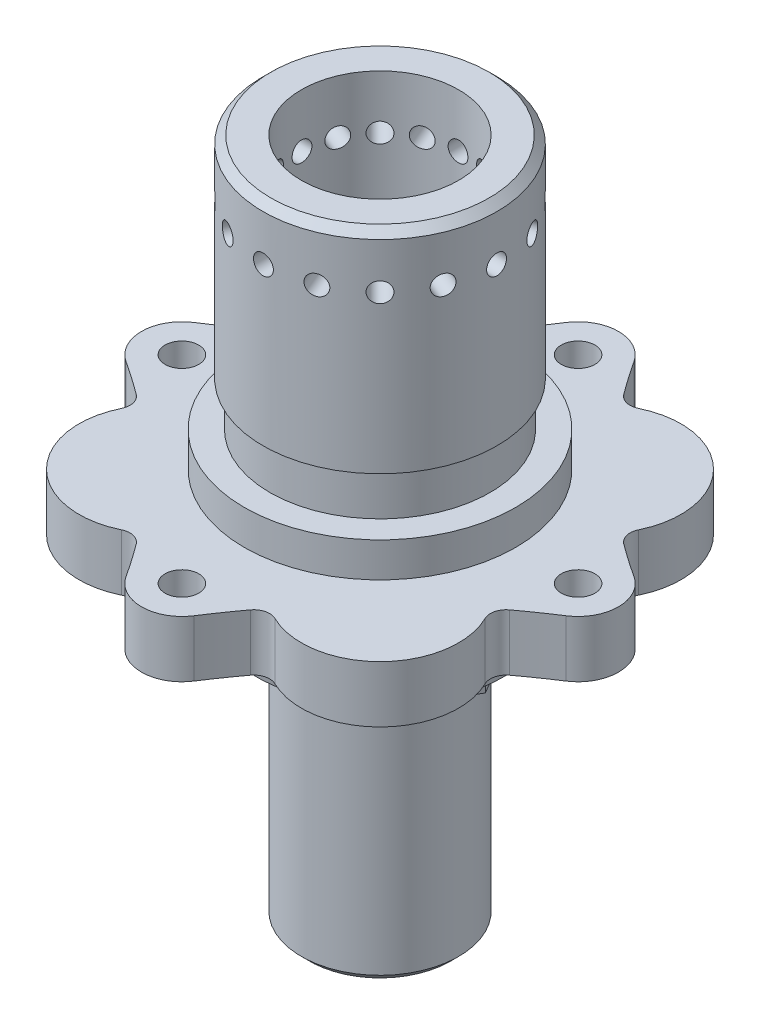
from build123d import *

# Parameters (mm, degrees)
SKETCH5_W                     = 15.875
SKETCH5_H                     = 79.375
DRIVE_PIN_HOLES_D             = 6.8
DRIVE_PIN_HOLES_PATTERN_COUNT = 4
FLANGE_SUPPORT_CUT_REACH      = 103.939
SKETCH8_R                     = 52.5
SKETCH10_R                    = 25.0825
BRAKE_HAT_HEX_DEPTH           = 4.7625
M10_CLEARANCE_HOLE1_D         = 11
SKETCH14_R                    = 2
PIN_HOLES_DEPTH               = 98.561648779
PIN_HOLE_PATTERN_COUNT        = 16
FILLET1_R                     = 3.175


with BuildPart() as part:
    # Sketch1 → Bearing Shaft/Flange Support (revolve)
    with BuildSketch(Plane(origin=(0, 0, 0), x_dir=(0, 0, -1), z_dir=(1, 0, 0)), mode=Mode.PRIVATE) as bearing_shaft_flange_support_sk:
        Polygon((0, 0), (-27.254672075, 0), (-25.0825, -12.319), (-25.0825, -17.0815), (-15.875, -17.0815), (-15.875, -65.8749), (-14.2875, -67.4624), (0, -67.4624), align=None)
    revolve(bearing_shaft_flange_support_sk.sketch.rotate(Axis((0, 0, 0), (0, 1, 0)), 180), axis=Axis((0, 0, 0), (0, 1, 0)))

    # Sketch2 → Drive Pin Support (revolve)
    with BuildSketch(Plane(origin=(0, 0, 0), x_dir=(0, 0, -1), z_dir=(1, 0, 0)), mode=Mode.PRIVATE) as drive_pin_support_sk:
        Polygon((0, 0), (-52.5, 0), (-52.5, 11.43), (-27.4096, 11.43), (-27.4096, 18.43), (-22.225, 18.43), (-22.225, 27.305), (-23.61946, 27.305), (-23.61946, 68.2625), (-22.03196, 69.85), (0, 69.85), align=None)
    revolve(drive_pin_support_sk.sketch.rotate(Axis((0, 0, 0), (0, 1, 0)), 180), axis=Axis((0, 0, 0), (0, 1, 0)))

    # Sketch5 → Center Mass Removal (revolve, cut)
    with BuildSketch(Plane(origin=(0, 0, 0), x_dir=(0, 0, -1), z_dir=(1, 0, 0)), mode=Mode.PRIVATE) as center_mass_removal_sk:
        with Locations((7.9375, 30.1625)):
            Rectangle(SKETCH5_W, SKETCH5_H)
    revolve(center_mass_removal_sk.sketch.rotate(Axis((0, 0, 0), (0, -1, 0)), 180), axis=Axis((0, 0, 0), (0, -1, 0)), mode=Mode.SUBTRACT)

    # Drive Pin Holes (through all)
    with Locations(Plane(origin=(0, 0, 0), x_dir=(-1, 0, 0), z_dir=(0, -1, 0))):
        with Locations((0, -40)):
            drive_pin_holes = Hole(DRIVE_PIN_HOLES_D / 2)

    # Drive Pin Holes Pattern: Drive Pin Holes ×4 about axis
    drive_pin_holes_pattern_axis = Axis((0, 0, 0), (0, 1, 0))
    for i in range(1, DRIVE_PIN_HOLES_PATTERN_COUNT):
        add(drive_pin_holes.rotate(drive_pin_holes_pattern_axis, i * 360 / DRIVE_PIN_HOLES_PATTERN_COUNT), mode=Mode.SUBTRACT)

    # Sketch8 → Flange Support Cut (cut, up to next)
    with BuildSketch(Plane.XZ, mode=Mode.PRIVATE) as flange_support_cut_sk1:
        Circle(SKETCH8_R)
        with BuildLine():
            ThreePointArc((6.851776468, 44.436165629), (0, 48.1625), (-6.851776468, 44.436165629))
            ThreePointArc((-6.851776468, 44.436165629), (-9.964767607, 39.850591878), (-13.274865482, 35.405206349))
            ThreePointArc((-13.274865482, 35.405206349), (-33.675960454, 33.675960454), (-35.405206349, 13.274865482))
            ThreePointArc((-35.405206349, 13.274865482), (-39.850591878, 9.964767607), (-44.436165629, 6.851776468))
            ThreePointArc((-44.436165629, 6.851776468), (-48.1625, 0), (-44.436165629, -6.851776468))
            ThreePointArc((-44.436165629, -6.851776468), (-39.850591878, -9.964767607), (-35.405206349, -13.274865482))
            ThreePointArc((-35.405206349, -13.274865482), (-33.675960454, -33.675960454), (-13.274865482, -35.405206349))
            ThreePointArc((-13.274865482, -35.405206349), (-9.964767607, -39.850591878), (-6.851776468, -44.436165629))
            ThreePointArc((-6.851776468, -44.436165629), (0, -48.1625), (6.851776468, -44.436165629))
            ThreePointArc((6.851776468, -44.436165629), (9.964767607, -39.850591878), (13.274865482, -35.405206349))
            ThreePointArc((13.274865482, -35.405206349), (33.675960454, -33.675960454), (35.405206349, -13.274865482))
            ThreePointArc((35.405206349, -13.274865482), (39.850591878, -9.964767607), (44.436165629, -6.851776468))
            ThreePointArc((44.436165629, -6.851776468), (48.1625, 0), (44.436165629, 6.851776468))
            ThreePointArc((44.436165629, 6.851776468), (39.850591878, 9.964767607), (35.405206349, 13.274865482))
            ThreePointArc((35.405206349, 13.274865482), (33.675960454, 33.675960454), (13.274865482, 35.405206349))
            ThreePointArc((13.274865482, 35.405206349), (9.964767607, 39.850591878), (6.851776468, 44.436165629))
        make_face(mode=Mode.SUBTRACT)
    flange_support_cut_tool1 = extrude(flange_support_cut_sk1.sketch, amount=-FLANGE_SUPPORT_CUT_REACH, mode=Mode.PRIVATE) & part.part
    add(flange_support_cut_tool1.solids().sort_by_distance((-51.015076, 0, 0))[0], mode=Mode.SUBTRACT)

    # Sketch10 → Brake Hat Hex (cut)
    with BuildSketch(Plane.XZ.offset(17.0815)):
        Circle(SKETCH10_R)
        Polygon((10.631905207, -18.415), (21.263810414, 0), (10.631905207, 18.415), (-10.631905207, 18.415), (-21.263810414, 0), (-10.631905207, -18.415), align=None, mode=Mode.SUBTRACT)
    extrude(amount=-BRAKE_HAT_HEX_DEPTH, mode=Mode.SUBTRACT)

    # M10 Clearance Hole1 (through all)
    with Locations(Plane(origin=(0, -67.4624, 0), x_dir=(-1, 0, 0), z_dir=(0, -1, 0))):
        with Locations((0, 0)):
            Hole(M10_CLEARANCE_HOLE1_D / 2)

    # Sketch14 → Pin Holes (cut, through all)
    with BuildSketch(Plane(origin=(0, 0, 0), x_dir=(0, 0, -1), z_dir=(1, 0, 0))):
        with Locations((0, 59.05)):
            Circle(SKETCH14_R)
    pin_holes = extrude(amount=-PIN_HOLES_DEPTH, mode=Mode.SUBTRACT)

    # Pin Hole Pattern: Pin Holes ×16 about axis
    pin_hole_pattern_axis = Axis((0, 0, 0), (0, -1, 0))
    for i in range(1, PIN_HOLE_PATTERN_COUNT):
        add(pin_holes.rotate(pin_hole_pattern_axis, i * 360 / PIN_HOLE_PATTERN_COUNT), mode=Mode.SUBTRACT)

    # Fillet1
    fillet1_edges = [part.edges().sort_by_distance(p)[0] for p in [
        (-35.405206349, 5.715, -13.274865482),
        (-13.274865482, 5.715, -35.405206349),
        (13.274865482, 5.715, -35.405206349),
        (35.405206349, 5.715, -13.274865482),
        (35.405206349, 5.715, 13.274865482),
        (13.274865482, 5.715, 35.405206349),
        (-13.274865482, 5.715, 35.405206349),
        (-35.405206349, 5.715, 13.274865482),
    ]]
    fillet(fillet1_edges, radius=FILLET1_R)


solid = part.part
